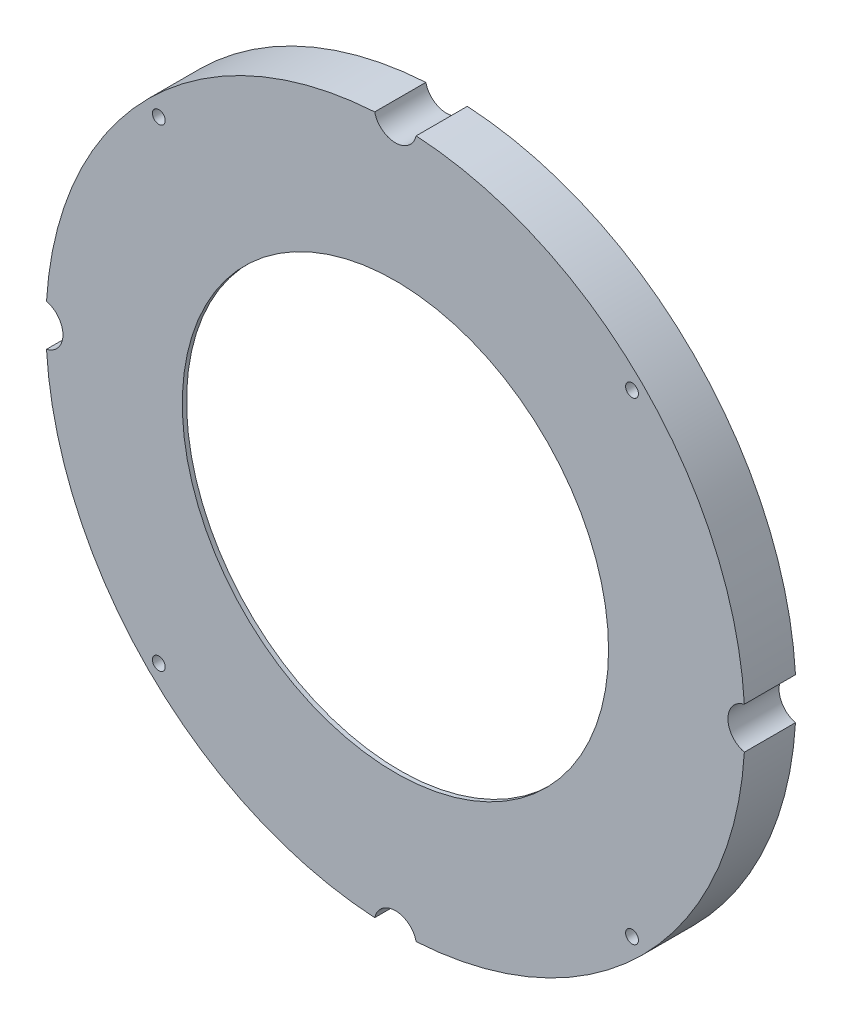
from build123d import *
from build123d.topology import SkipClean

# Parameters (mm, degrees)
SKETCH1_R           = 82
SKETCH1_R_2         = 50
BOSS_EXTRUDE1_DEPTH = 1
BOSS_EXTRUDE3_START = 11
SKETCH3_R           = 82
SKETCH3_R_2         = 75
BOSS_EXTRUDE3_DEPTH = 11
SKETCH4_R           = 5
CUT_EXTRUDE1_DEPTH  = 117.584733134
CIRPATTERN1_COUNT   = 4
SKETCH5_R           = 1.5
CUT_EXTRUDE2_DEPTH  = 117.381356407
CIRPATTERN2_COUNT   = 4


with BuildPart() as part:
    # Sketch1 → Boss-Extrude1 (new body)
    with BuildSketch(Plane.XY):
        Circle(SKETCH1_R)
        Circle(SKETCH1_R_2, mode=Mode.SUBTRACT)
    extrude(amount=BOSS_EXTRUDE1_DEPTH)

    # Sketch3 → Boss-Extrude3 (add)
    with BuildSketch(Plane(origin=(0, 0, 0), x_dir=(-1, 0, 0), z_dir=(0, 0, -1)).offset(BOSS_EXTRUDE3_START)):
        Circle(SKETCH3_R)
        Circle(SKETCH3_R_2, mode=Mode.SUBTRACT)
    extrude(amount=-BOSS_EXTRUDE3_DEPTH)

    # Sketch4 → Cut-Extrude1 (cut, through all)
    with SkipClean():  # the faces are left unmerged after this step: merging them gives an invalid solid
        with BuildSketch(Plane.XY.offset(1)):
            with Locations((0, 83)):
                Circle(SKETCH4_R)
        cut_extrude1 = extrude(amount=-CUT_EXTRUDE1_DEPTH, mode=Mode.SUBTRACT)

    # CirPattern1: Cut-Extrude1 ×4 about axis
    cirpattern1_axis = Axis((0, 0, 0), (0, 0, 1))
    for i in range(1, CIRPATTERN1_COUNT):
        add(cut_extrude1.rotate(cirpattern1_axis, i * 360 / CIRPATTERN1_COUNT), mode=Mode.SUBTRACT)

    # Sketch5 → Cut-Extrude2 (cut, through all)
    with BuildSketch(Plane(origin=(0, 0, -11), x_dir=(-1, 0, 0), z_dir=(0, 0, -1))):
        with Locations((55.507882323, 55.507882323)):
            Circle(SKETCH5_R)
    cut_extrude2 = extrude(amount=-CUT_EXTRUDE2_DEPTH, mode=Mode.SUBTRACT)

    # CirPattern2: Cut-Extrude2 ×4 about axis
    cirpattern2_axis = Axis((0, 0, 0), (0, 0, 1))
    for i in range(1, CIRPATTERN2_COUNT):
        add(cut_extrude2.rotate(cirpattern2_axis, i * 360 / CIRPATTERN2_COUNT), mode=Mode.SUBTRACT)


solid = part.part
